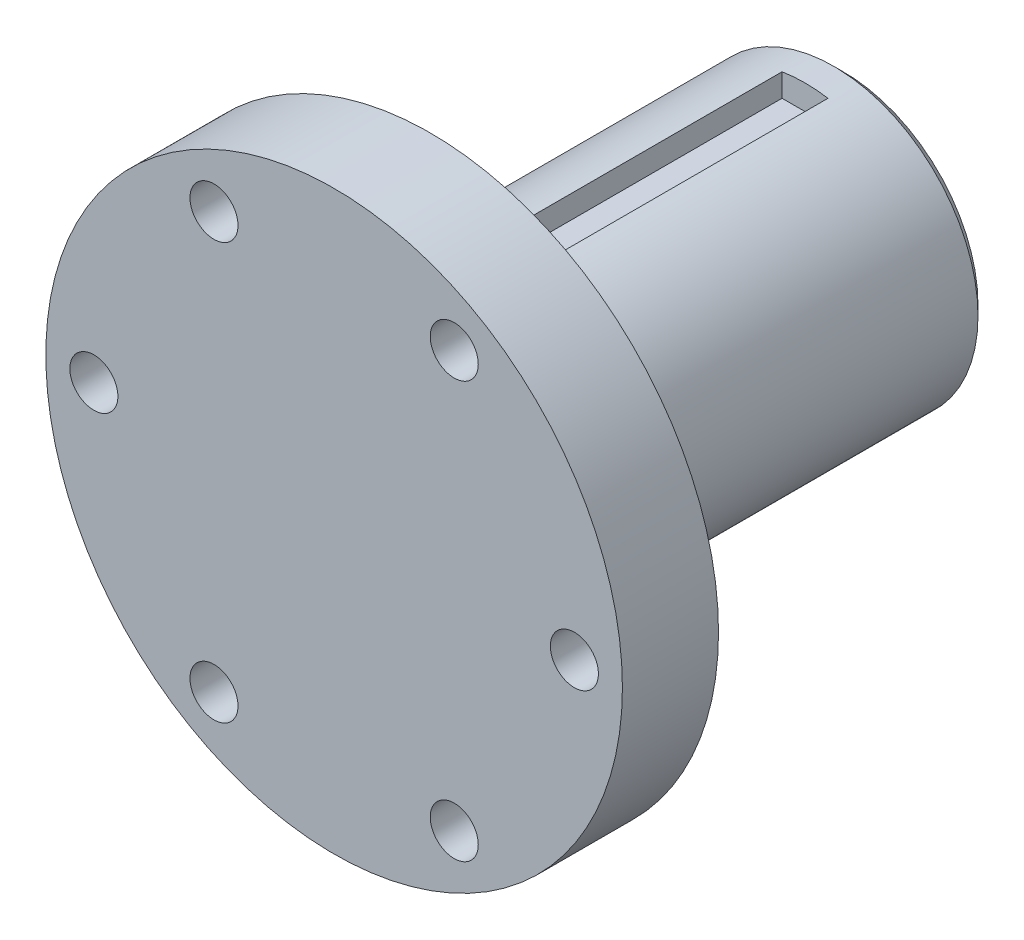
from build123d import *

# Parameters (mm, degrees)
SZKIC1_R                    = 15
DODANIE_WYCI_GNI_CIE1_DEPTH = 53
SFAZOWANIE1_SIZE            = 1
WYTNIJ_WYCI_GNI_CIE1_DEPTH  = 35
SZKIC3_R                    = 30
DODANIE_WYCI_GNI_CIE2_DEPTH = 10
SZKIC4_R                    = 2.5
WYTNIJ_WYCI_GNI_CIE2_DEPTH  = 61.406953242
SZYK_KO_OWY1_COUNT          = 6


with BuildPart() as part:
    # Szkic1 → Dodanie-wyciągnięcie1 (new body)
    with BuildSketch(Plane.XY):
        Circle(SZKIC1_R)
    extrude(amount=DODANIE_WYCI_GNI_CIE1_DEPTH)

    # Sfazowanie1
    sfazowanie1_edges = [part.edges().sort_by_distance(p)[0] for p in [
        (-15, 0, 0),
    ]]
    chamfer(sfazowanie1_edges, length=SFAZOWANIE1_SIZE)

    # Szkic2 → Wytnij-wyciągnięcie1 (cut)
    with BuildSketch(Plane(origin=(0, 0, 4), x_dir=(-1, 0, 0), z_dir=(0, 0, -1))):
        with BuildLine():
            Line((-2.39, 14.808372632), (-2.39, 12.418372632))
            Line((-2.39, 12.418372632), (2.39, 12.418372632))
            Line((2.39, 12.418372632), (2.39, 14.808372632))
            ThreePointArc((2.39, 14.808372632), (0, 15), (-2.39, 14.808372632))
        make_face()
    extrude(amount=-WYTNIJ_WYCI_GNI_CIE1_DEPTH, mode=Mode.SUBTRACT)

    # Szkic3 → Dodanie-wyciągnięcie2 (add)
    with BuildSketch(Plane.XY.offset(53)):
        Circle(SZKIC3_R)
    extrude(amount=-DODANIE_WYCI_GNI_CIE2_DEPTH)

    # Szkic4 → Wytnij-wyciągnięcie2 (cut, through all)
    with BuildSketch(Plane(origin=(0, 0, 43), x_dir=(-1, 0, 0), z_dir=(0, 0, -1))):
        with Locations((-25, 0)):
            Circle(SZKIC4_R)
    wytnij_wyci_gni_cie2 = extrude(amount=-WYTNIJ_WYCI_GNI_CIE2_DEPTH, mode=Mode.SUBTRACT)

    # Szyk kołowy1: Wytnij-wyciągnięcie2 ×6 about axis
    szyk_ko_owy1_axis = Axis((0, 0, 0), (0, 0, 1))
    for i in range(1, SZYK_KO_OWY1_COUNT):
        add(wytnij_wyci_gni_cie2.rotate(szyk_ko_owy1_axis, i * 360 / SZYK_KO_OWY1_COUNT), mode=Mode.SUBTRACT)


solid = part.part
